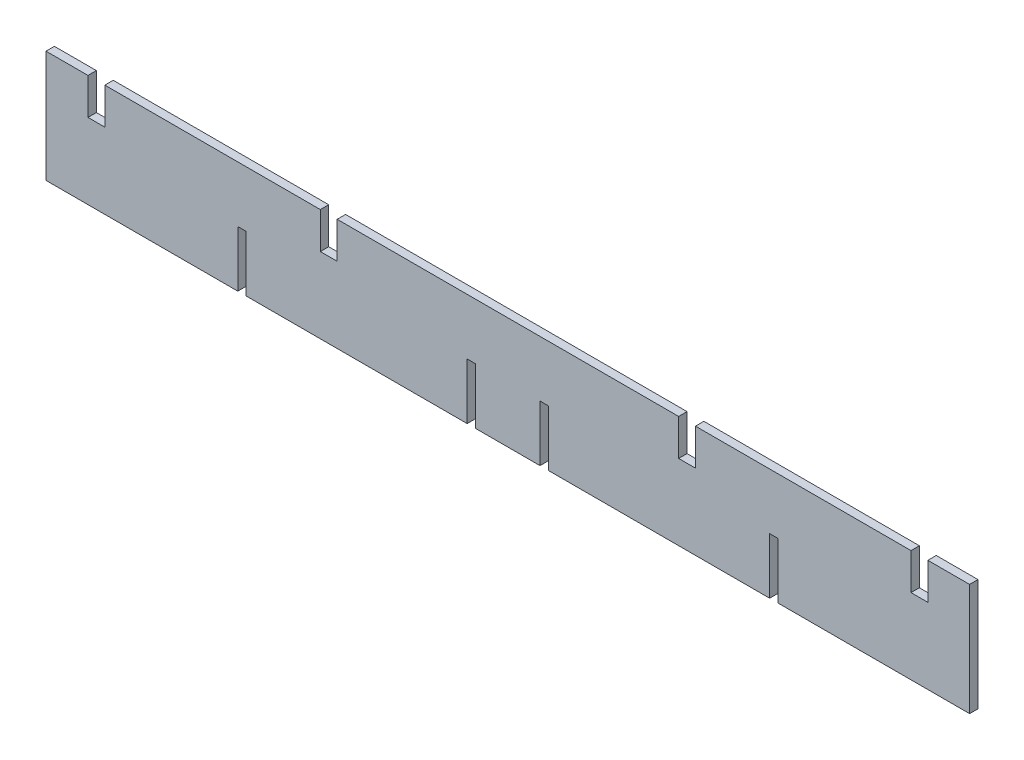
from build123d import *

# Parameters (mm, degrees)
SKETCH1_W           = 660
SKETCH1_H           = 80
BOSS_EXTRUDE1_DEPTH = 6
SKETCH2_W           = 12.04
SKETCH2_H           = 26
CUT_EXTRUDE1_DEPTH  = 333.469547478
SKETCH3_W           = 6.04
SKETCH3_H           = 40
CUT_EXTRUDE2_DEPTH  = 333.469547478
CUT_EXTRUDE3_REACH  = 334.47
SKETCH4_W           = 6
SKETCH4_H           = 40


with BuildPart() as part:
    # Sketch1 → Boss-Extrude1 (new body)
    with BuildSketch(Plane.XY):
        Rectangle(SKETCH1_W, SKETCH1_H)
    extrude(amount=BOSS_EXTRUDE1_DEPTH)

    # Sketch2 → Cut-Extrude1 (cut, through all)
    with BuildSketch(Plane.XY.offset(6)):
        with Locations((-293.98, 27)):
            Rectangle(SKETCH2_W, SKETCH2_H)
        with Locations((-127.94, 27)):
            Rectangle(SKETCH2_W, SKETCH2_H)
        with Locations((128.1, 27)):
            Rectangle(SKETCH2_W, SKETCH2_H)
        with Locations((294.14, 27)):
            Rectangle(SKETCH2_W, SKETCH2_H)
    extrude(amount=-CUT_EXTRUDE1_DEPTH, mode=Mode.SUBTRACT)

    # Sketch3 → Cut-Extrude2 (cut, through all)
    with BuildSketch(Plane.XY.offset(6)):
        with Locations((-26.02, -20)):
            Rectangle(SKETCH3_W, SKETCH3_H)
        with Locations((26.02, -20)):
            Rectangle(SKETCH3_W, SKETCH3_H)
    extrude(amount=-CUT_EXTRUDE2_DEPTH, mode=Mode.SUBTRACT)

    # Sketch4 → Cut-Extrude3 (cut, up to next)
    with BuildSketch(Plane.XY.offset(6), mode=Mode.PRIVATE) as cut_extrude3_sk1:
        with Locations((-189.96, -20)):
            Rectangle(SKETCH4_W, SKETCH4_H)
    cut_extrude3_tool1 = extrude(cut_extrude3_sk1.sketch, amount=-CUT_EXTRUDE3_REACH, mode=Mode.PRIVATE) & part.part
    # Sketch4 → Cut-Extrude3 (cut, up to next)
    with BuildSketch(Plane.XY.offset(6), mode=Mode.PRIVATE) as cut_extrude3_sk2:
        with Locations((190.12, -20)):
            Rectangle(SKETCH4_W, SKETCH4_H)
    cut_extrude3_tool2 = extrude(cut_extrude3_sk2.sketch, amount=-CUT_EXTRUDE3_REACH, mode=Mode.PRIVATE) & part.part
    add(cut_extrude3_tool1.solids().sort_by_distance((-189.96, -20, 6))[0], mode=Mode.SUBTRACT)
    add(cut_extrude3_tool2.solids().sort_by_distance((190.12, -20, 6))[0], mode=Mode.SUBTRACT)


solid = part.part
